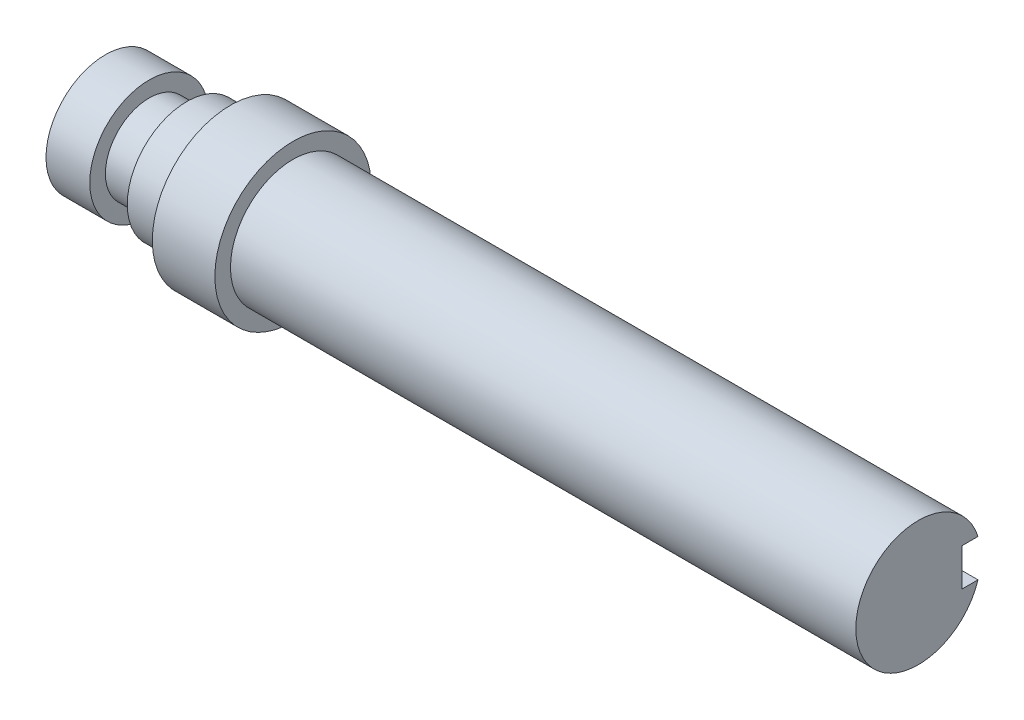
from build123d import *

# Parameters (mm, degrees)
SKETCH2_W          = 20
SKETCH2_H          = 3
CUT_EXTRUDE1_DEPTH = 3


with BuildPart() as part:
    # Sketch1 → Revolve1 (revolve)
    with BuildSketch(Plane(origin=(0, 0, 0), x_dir=(1, 0, 0), z_dir=(0, 1, 0)), mode=Mode.PRIVATE) as revolve1_sk:
        Polygon((0, 0), (130, 0), (130, 10), (30, 10), (30, 12.5), (20, 12.5), (20, 9.5), (13, 9.5), (13, 7), (7, 7), (7, 9.5), (0, 9.5), align=None)
    revolve(revolve1_sk.sketch.rotate(Axis((0, 0, 0), (1, 0, 0)), 180), axis=Axis((0, 0, 0), (1, 0, 0)))

    # Sketch2 → Cut-Extrude1 (cut, symmetric)
    with BuildSketch(Plane(origin=(0, 0, 0), x_dir=(1, 0, 0), z_dir=(0, 1, 0))):
        with Locations((120, 8.5)):
            Rectangle(SKETCH2_W, SKETCH2_H)
    extrude(amount=CUT_EXTRUDE1_DEPTH, both=True, mode=Mode.SUBTRACT)


solid = part.part
